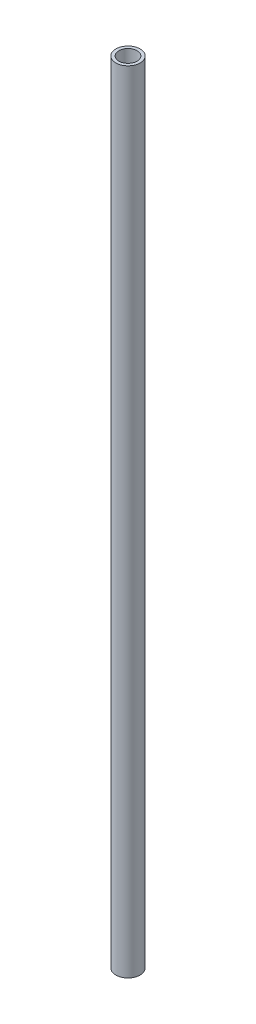
from build123d import *

# Parameters (mm, degrees)
SKETCH1_R           = 1
SKETCH1_R_2         = 0.75
BOSS_EXTRUDE1_DEPTH = 32.5


with BuildPart() as part:
    # Sketch1 → Boss-Extrude1 (new, symmetric)
    with BuildSketch(Plane(origin=(0, 0, 0), x_dir=(1, 0, 0), z_dir=(0, 1, 0))):
        with Locations(Location((0, 0, 0), (0, 0, 270))):
            Circle(SKETCH1_R)
        with Locations(Location((0, 0, 0), (0, 0, 270))):
            Circle(SKETCH1_R_2, mode=Mode.SUBTRACT)
    extrude(amount=BOSS_EXTRUDE1_DEPTH, both=True)


solid = part.part
